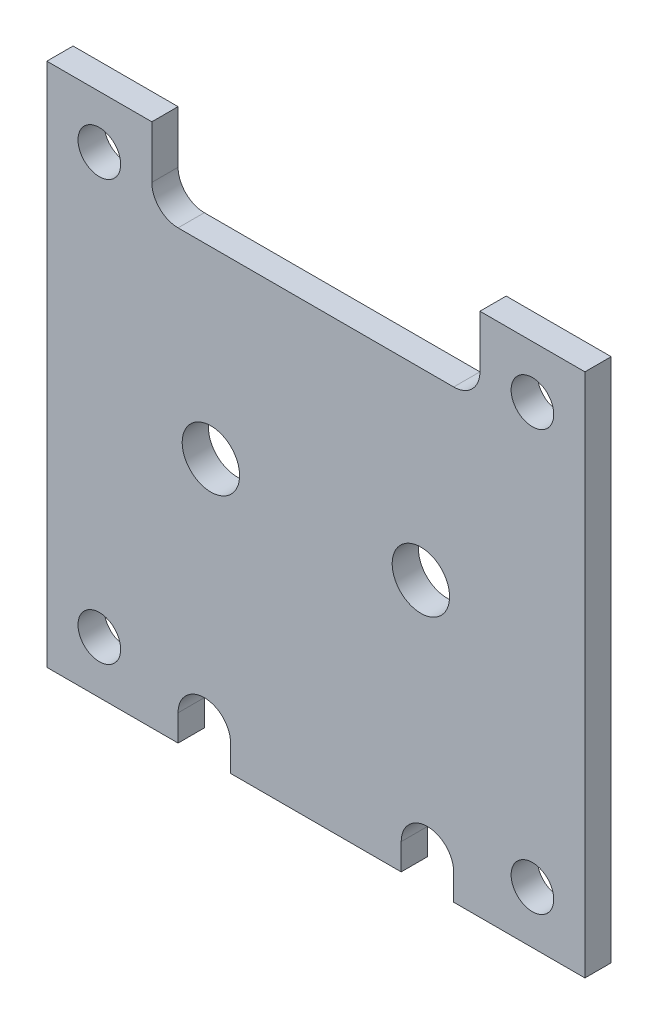
from build123d import *

# Parameters (mm, degrees)
SKETCH1_W               = 130.175
SKETCH1_H               = 127
EXTRUDE1_DEPTH          = 6.35
F_3_8_CLEARANCE_HOLE1_D = 10.31748
SKETCH4_W               = 79.375
SKETCH4_H               = 19.05
EXTRUDE2_DEPTH          = 92.153470347
FILLET2_R               = 6.35
SKETCH5_W               = 12.7
SKETCH5_H               = 6.35
EXTRUDE3_DEPTH          = 92.153470347
SKETCH6_R               = 6.35
EXTRUDE4_DEPTH          = 92.153470347
F_1_2_CLEARANCE_HOLE1_D = 13.89126


with BuildPart() as part:
    # Sketch1 → Extrude1 (new body)
    with BuildSketch(Plane.XY):
        Rectangle(SKETCH1_W, SKETCH1_H)
    extrude(amount=-EXTRUDE1_DEPTH)

    # 3/8 Clearance Hole1 (through all)
    with Locations(Plane.XY):
        with Locations((-52.3875, 50.8), (52.3875, 50.8), (52.3875, -50.8), (-52.3875, -50.8)):
            Hole(F_3_8_CLEARANCE_HOLE1_D / 2)

    # Sketch4 → Extrude2 (cut, through all)
    with BuildSketch(Plane.XY):
        with Locations((0, 53.975)):
            Rectangle(SKETCH4_W, SKETCH4_H)
    extrude(amount=-EXTRUDE2_DEPTH, mode=Mode.SUBTRACT)

    # Fillet2
    fillet2_edges = [part.edges().sort_by_distance(p)[0] for p in [
        (-39.6875, 44.45, -3.175),
        (39.6875, 44.45, -3.175),
    ]]
    fillet(fillet2_edges, radius=FILLET2_R)

    # Sketch5 → Extrude3 (cut, through all)
    with BuildSketch(Plane(origin=(0, 0, -6.35), x_dir=(-1, 0, 0), z_dir=(0, 0, -1))):
        with Locations((-26.9875, -60.325)):
            Rectangle(SKETCH5_W, SKETCH5_H)
    extrude3 = extrude(amount=-EXTRUDE3_DEPTH, mode=Mode.SUBTRACT)

    # Sketch6 → Extrude4 (cut, through all)
    with BuildSketch(Plane(origin=(0, 0, -6.35), x_dir=(-1, 0, 0), z_dir=(0, 0, -1))):
        with Locations((-26.9875, -57.15)):
            Circle(SKETCH6_R)
    extrude4 = extrude(amount=-EXTRUDE4_DEPTH, mode=Mode.SUBTRACT)

    # Mirror2: Extrude3, Extrude4 across plane
    add(extrude3.mirror(Plane(origin=(0, 0, 0), x_dir=(0, 0, 1), z_dir=(1, 0, 0))), mode=Mode.SUBTRACT)
    add(extrude4.mirror(Plane(origin=(0, 0, 0), x_dir=(0, 0, 1), z_dir=(1, 0, 0))), mode=Mode.SUBTRACT)

    # 1/2 Clearance Hole1 (through all)
    with Locations(Plane(origin=(0, 0, -6.35), x_dir=(-1, 0, 0), z_dir=(0, 0, -1))):
        with Locations((-25.4, 0), (25.4, 0)):
            Hole(F_1_2_CLEARANCE_HOLE1_D / 2)


solid = part.part
